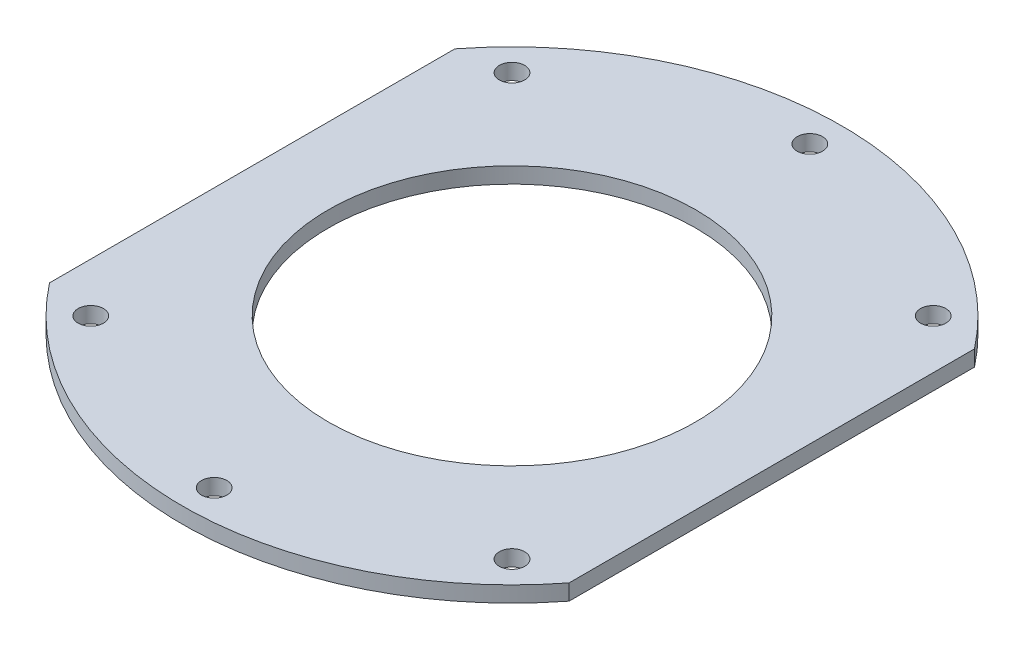
from build123d import *

# Parameters (mm, degrees)
SKETCH_1_R          = 52
SKETCH_1_R_2        = 29
SKETCH_1_R_3        = 2
EXTRUDE_1_DEPTH     = 2.5
SKETCH_2_W          = 182
SKETCH_2_H          = 210.035227354
SKETCH_2_W_2        = 82
SKETCH_2_H_2        = 110.035227354
CUT_EXTRUDE_1_DEPTH = 4


with BuildPart() as part:
    # 草图1 → 凸台-拉伸1 (new body)
    with BuildSketch(Plane(origin=(0, 0, 0), x_dir=(1, 0, 0), z_dir=(0, 1, 0))):
        with Locations(Location((0, 0, 0), (0, 0, 270))):
            Circle(SKETCH_1_R)
        with Locations(Location((0, 0, 0), (0, 0, 270))):
            Circle(SKETCH_1_R_2, mode=Mode.SUBTRACT)
        with Locations(Location((47, 0, 0), (0, 0, 270))):
            Circle(SKETCH_1_R_3, mode=Mode.SUBTRACT)
        with Locations(Location((33.234018716, -33.234018716, 0), (0, 0, 270))):
            Circle(SKETCH_1_R_3, mode=Mode.SUBTRACT)
        with Locations(Location((0, -47, 0), (0, 0, 270))):
            Circle(SKETCH_1_R_3, mode=Mode.SUBTRACT)
        with Locations(Location((-33.234018716, -33.234018716, 0), (0, 0, 270))):
            Circle(SKETCH_1_R_3, mode=Mode.SUBTRACT)
        with Locations(Location((-47, 0, 0), (0, 0, 270))):
            Circle(SKETCH_1_R_3, mode=Mode.SUBTRACT)
        with Locations(Location((-33.234018716, 33.234018716, 0), (0, 0, 270))):
            Circle(SKETCH_1_R_3, mode=Mode.SUBTRACT)
        with Locations(Location((0, 47, 0), (0, 0, 270))):
            Circle(SKETCH_1_R_3, mode=Mode.SUBTRACT)
        with Locations(Location((33.234018716, 33.234018716, 0), (0, 0, 270))):
            Circle(SKETCH_1_R_3, mode=Mode.SUBTRACT)
    extrude(amount=EXTRUDE_1_DEPTH)

    # 草图2 → 切除-拉伸-薄壁1 (cut)
    with BuildSketch(Plane(origin=(0, 2.5, 0), x_dir=(1, 0, 0), z_dir=(0, 1, 0))):
        Rectangle(SKETCH_2_W, SKETCH_2_H)
        Rectangle(SKETCH_2_W_2, SKETCH_2_H_2, mode=Mode.SUBTRACT)
    extrude(amount=-CUT_EXTRUDE_1_DEPTH, mode=Mode.SUBTRACT)


solid = part.part
